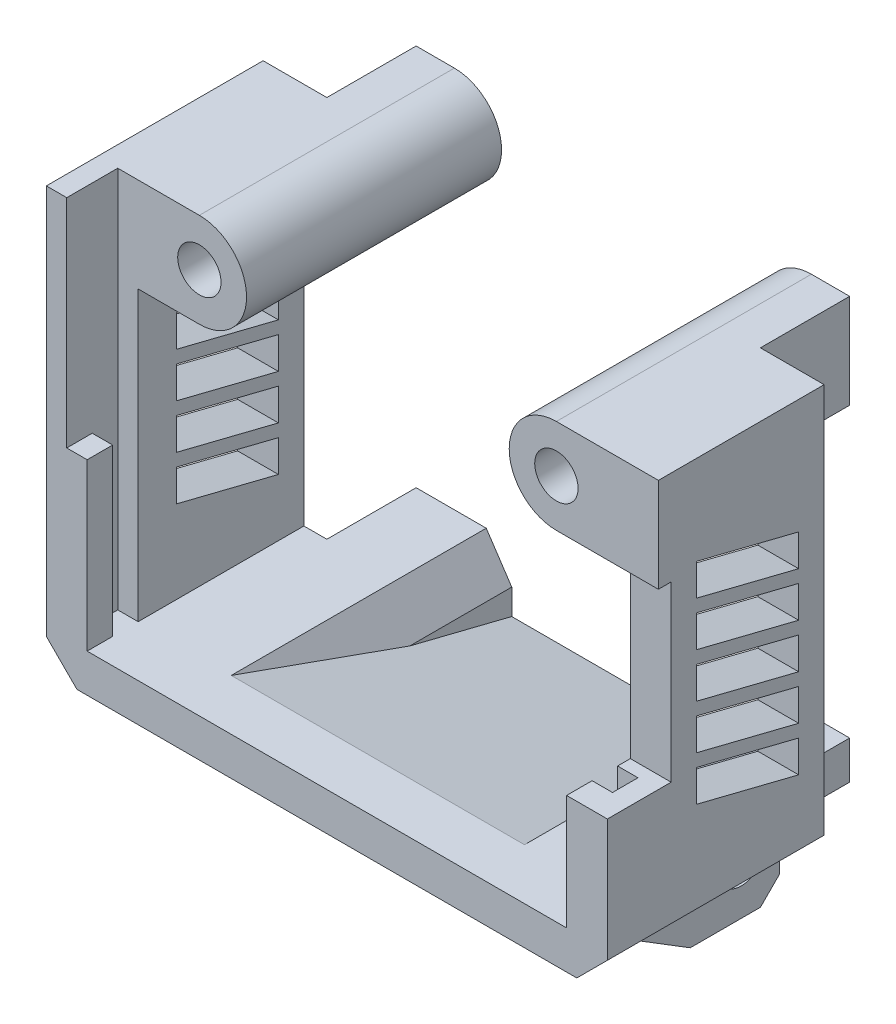
from build123d import *

# Parameters (mm, degrees)
SKETCH_1_W           = 44
SKETCH_1_H           = 34
EXTRUDE_1_DEPTH      = 24
CUT_EXTRUDE_1_DEPTH  = 31
SKETCH_5_W           = 23
SKETCH_5_H           = 10.5
EXTRUDE_4_DEPTH      = 1
EXTRUDE_5_DEPTH      = 23
SKETCH_7_R           = 1.8
CUT_EXTRUDE_2_DEPTH  = 23
CUT_EXTRUDE_4_DEPTH  = 19
CHAMFER_2_SIZE       = 2
CHAMFER_2_SIZE2      = 3
SKETCH_11_R          = 1.7
EXTRUDE_6_DEPTH      = 20
CUT_EXTRUDE_7_DEPTH  = 4
CHAMFER_3_SIZE       = 2.4
SKETCH_14_W          = 40.8
SKETCH_14_H          = 4
CUT_EXTRUDE_8_DEPTH  = 18
SKETCH_15_W          = 44
SKETCH_15_H          = 1
CUT_EXTRUDE_9_DEPTH  = 24
SKETCH_16_W          = 3.2
SKETCH_16_H          = 13.6
CUT_EXTRUDE_10_DEPTH = 5
SKETCH_17_W          = 1.6
SKETCH_17_H          = 4
CUT_EXTRUDE_11_DEPTH = 7.4
CUT_EXTRUDE_12_DEPTH = 7
SKETCH_19_W          = 1
SKETCH_19_H          = 10.5
CUT_EXTRUDE_13_DEPTH = 23
CHAMFER_4_SIZE       = 1.5
CHAMFER_5_SIZE       = 3
CHAMFER_5_SIZE2      = 2


with BuildPart() as part:
    # Эскиз1 → Бобышка-Вытянуть1 (new body)
    with BuildSketch(Plane.XY):
        with Locations((0, 27)):
            Rectangle(SKETCH_1_W, SKETCH_1_H)
    extrude(amount=EXTRUDE_1_DEPTH)

    # Эскиз2 → Вырез-Вытянуть1 (cut)
    with BuildSketch(Plane(origin=(0, 44, 0), x_dir=(1, 0, 0), z_dir=(0, 1, 0))):
        Polygon((-18.8, 0), (18.8, 0), (18.8, -20), (20.4, -20), (20.4, -22), (18.8, -22), (18.8, -24), (-18.8, -24), (-18.8, -22), (-20.4, -22), (-20.4, -20), (-18.8, -20), align=None)
    extrude(amount=-CUT_EXTRUDE_1_DEPTH, mode=Mode.SUBTRACT)



with BuildPart() as body_2:
    # Эскиз5 → Бобышка-Вытянуть4 (new body)
    with BuildSketch(Plane(origin=(0, 0, 0), x_dir=(-1, 0, 0), z_dir=(0, 0, -1))):
        with Locations((0, 4.75)):
            Rectangle(SKETCH_5_W, SKETCH_5_H)
    extrude(amount=EXTRUDE_4_DEPTH)


with BuildPart() as part_1:
    add(part.part)

    add(body_2.part)  # Бобышка-Вытянуть5 merges body 2
    # Эскиз6 → Бобышка-Вытянуть5 (add)
    with BuildSketch(Plane(origin=(11.5, 0, 0), x_dir=(0, 0, -1), z_dir=(1, 0, 0))):
        Polygon((0, -0.5), (-7, -0.5), (-24, 10), (0, 10), align=None)
    extrude(amount=-EXTRUDE_5_DEPTH)

    # Эскиз7 → Вырез-Вытянуть2 (cut)
    with BuildSketch(Plane.ZY.offset(11.5)):
        with Locations(Location((3, 3.5, 0), (0, 0, 270))):
            Circle(SKETCH_7_R)
    extrude(amount=-CUT_EXTRUDE_2_DEPTH, mode=Mode.SUBTRACT)

    # Эскиз8 → Вырез-Вытянуть4 (cut)
    with BuildSketch(Plane.ZY.offset(9.5)):
        Polygon((0, 8), (20, 13), (0, 13), align=None)
    extrude(amount=-CUT_EXTRUDE_4_DEPTH, mode=Mode.SUBTRACT)

    # Фаска2
    chamfer_2_edges = [part_1.edges().sort_by_distance(p)[0] for p in [
        (9.5, 13, 10),
    ]]
    chamfer_2_side = [part_1.faces().sort_by_distance(p)[0] for p in [
        (-18.32664601, 13, 10),
    ]]
    chamfer(chamfer_2_edges, length=CHAMFER_2_SIZE, length2=CHAMFER_2_SIZE2, reference=chamfer_2_side[0])

    # Эскиз11 → Бобышка-Вытянуть6 (add)
    # profile 1 of 2: a face of its own
    with BuildSketch(Plane(origin=(0, 0, 0), x_dir=(-1, 0, 0), z_dir=(0, 0, -1))):
        with BuildLine():
            Line((-14, 43), (-18.8, 43))
            Line((-18.8, 43), (-18.8, 35.6))
            Line((-18.8, 35.6), (-14, 35.6))
            ThreePointArc((-14, 35.6), (-10.3, 39.3), (-14, 43))
        make_face()
        with Locations((-14, 39.3)):
            Circle(SKETCH_11_R, mode=Mode.SUBTRACT)
    # profile 2 of 2: a face of its own
    with BuildSketch(Plane(origin=(0, 0, 0), x_dir=(-1, 0, 0), z_dir=(0, 0, -1))):
        with BuildLine():
            Line((18.8, 35.6), (14, 35.6))
            ThreePointArc((14, 35.6), (10.3, 39.3), (14, 43))
            Line((14, 43), (18.8, 43))
            Line((18.8, 43), (18.8, 35.6))
        make_face()
        with Locations((14, 39.3)):
            Circle(SKETCH_11_R, mode=Mode.SUBTRACT)
    extrude(amount=-EXTRUDE_6_DEPTH)

    # Эскиз13 → Вырез-Вытянуть7 (cut)
    with BuildSketch(Plane.ZY.offset(22)):
        Polygon((9, 34), (17, 36), (17, 33.5), (9, 31.5), align=None)
        Polygon((9, 30.5), (17, 32.5), (17, 30), (9, 28), align=None)
        Polygon((9, 27), (17, 29), (17, 26.5), (9, 24.5), align=None)
        Polygon((9, 23.5), (17, 25.5), (17, 23), (9, 21), align=None)
        Polygon((9, 20), (17, 22), (17, 19.5), (9, 17.5), align=None)
    cut_extrude_7 = extrude(amount=-CUT_EXTRUDE_7_DEPTH, mode=Mode.SUBTRACT)

    # Зеркальное отражение1: Вырез-Вытянуть7 across plane
    add(cut_extrude_7.mirror(Plane(origin=(0, 0, 0), x_dir=(0, 0, 1), z_dir=(1, 0, 0))), mode=Mode.SUBTRACT)

    # Фаска3
    chamfer_3_edges = [part_1.edges().sort_by_distance(p)[0] for p in [
        (22, 10, 12),
        (-22, 10, 12),
    ]]
    chamfer(chamfer_3_edges, length=CHAMFER_3_SIZE)

    # Эскиз14 → Вырез-Вытянуть8 (cut)
    with BuildSketch(Plane(origin=(0, 44, 0), x_dir=(1, 0, 0), z_dir=(0, 1, 0))):
        with Locations((0, -22)):
            Rectangle(SKETCH_14_W, SKETCH_14_H)
    extrude(amount=-CUT_EXTRUDE_8_DEPTH, mode=Mode.SUBTRACT)

    # Эскиз15 → Вырез-Вытянуть9 (cut)
    with BuildSketch(Plane(origin=(0, 0, 0), x_dir=(-1, 0, 0), z_dir=(0, 0, -1))):
        with Locations((0, 43.5)):
            Rectangle(SKETCH_15_W, SKETCH_15_H)
    extrude(amount=-CUT_EXTRUDE_9_DEPTH, mode=Mode.SUBTRACT)

    # Эскиз16 → Вырез-Вытянуть10 (cut)
    with BuildSketch(Plane.XY.offset(24)):
        with Locations((20.4, 28.8)):
            Rectangle(SKETCH_16_W, SKETCH_16_H)
    extrude(amount=-CUT_EXTRUDE_10_DEPTH, mode=Mode.SUBTRACT)

    # Эскиз17 → Вырез-Вытянуть11 (cut)
    with BuildSketch(Plane(origin=(0, 43, 0), x_dir=(1, 0, 0), z_dir=(0, 1, 0))):
        with Locations((21.2, -22)):
            Rectangle(SKETCH_17_W, SKETCH_17_H)
    extrude(amount=-CUT_EXTRUDE_11_DEPTH, mode=Mode.SUBTRACT)

    # Эскиз18 → Вырез-Вытянуть12 (cut)
    with BuildSketch(Plane(origin=(0, 0, 0), x_dir=(-1, 0, 0), z_dir=(0, 0, -1))):
        Polygon((-22, 43), (-17, 43), (-17, 10), (-19.6, 10), (-22, 12.4), align=None)
        Polygon((22, 12.4), (19.6, 10), (17, 10), (17, 43), (22, 43), align=None)
    extrude(amount=-CUT_EXTRUDE_12_DEPTH, mode=Mode.SUBTRACT)

    # Эскиз19 → Вырез-Вытянуть13 (cut)
    with BuildSketch(Plane.ZY.offset(11.5)):
        with Locations((-0.5, 4.75)):
            Rectangle(SKETCH_19_W, SKETCH_19_H)
    extrude(amount=-CUT_EXTRUDE_13_DEPTH, mode=Mode.SUBTRACT)

    # Фаска4
    chamfer_4_edges = [part_1.edges().sort_by_distance(p)[0] for p in [
        (0, -0.5, 0),
    ]]
    chamfer(chamfer_4_edges, length=CHAMFER_4_SIZE)

    # Фаска5
    chamfer_5_edges = [part_1.edges().sort_by_distance(p)[0] for p in [
        (-9.5, 13, 10),
    ]]
    chamfer_5_side = [part_1.faces().sort_by_distance(p)[0] for p in [
        (-9.5, 11.333333333, 6.666666667),
    ]]
    chamfer(chamfer_5_edges, length=CHAMFER_5_SIZE, length2=CHAMFER_5_SIZE2, reference=chamfer_5_side[0])


solid = part_1.part
